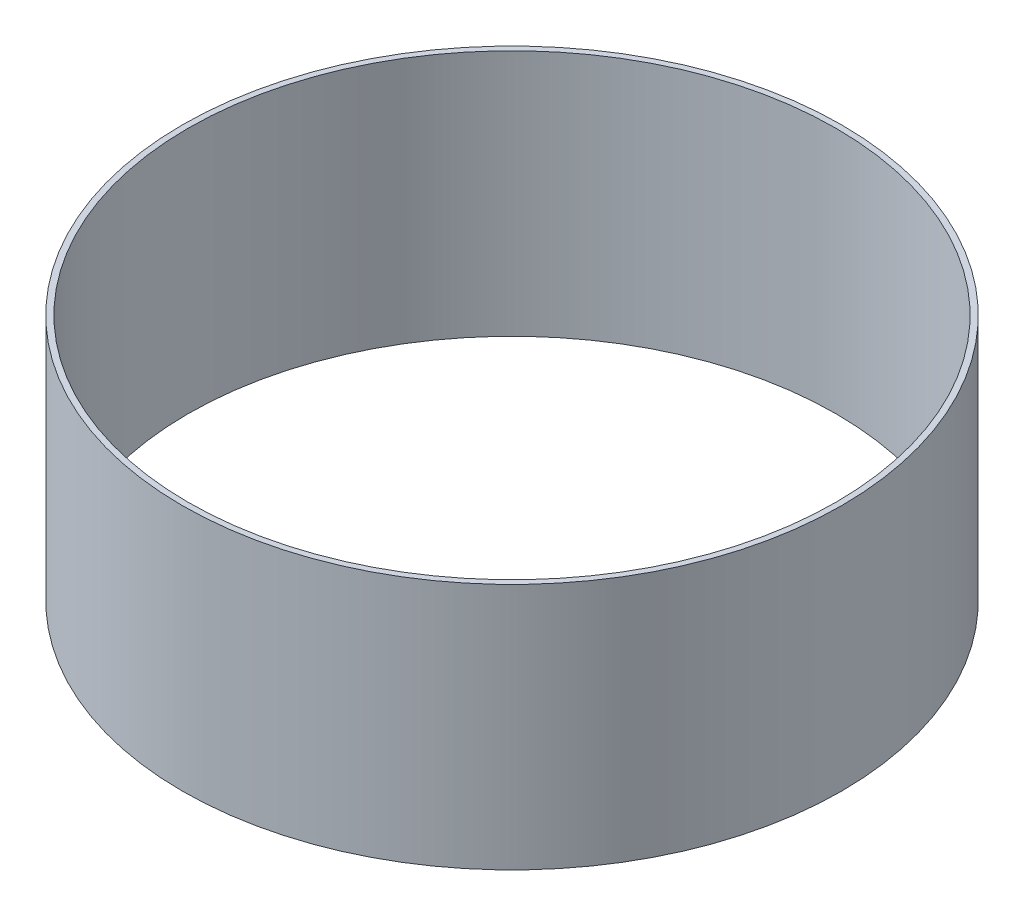
from build123d import *

# Parameters (mm, degrees)
SKETCH1_R           = 400
SKETCH1_R_2         = 393
BOSS_EXTRUDE1_DEPTH = 150


with BuildPart() as part:
    # Sketch1 → Boss-Extrude1 (new, symmetric)
    with BuildSketch(Plane(origin=(0, 0, 0), x_dir=(1, 0, 0), z_dir=(0, 1, 0))):
        with Locations(Location((0, 0, 0), (0, 0, 270))):
            Circle(SKETCH1_R)
        with Locations(Location((0, 0, 0), (0, 0, 270))):
            Circle(SKETCH1_R_2, mode=Mode.SUBTRACT)
    extrude(amount=BOSS_EXTRUDE1_DEPTH, both=True)


solid = part.part
